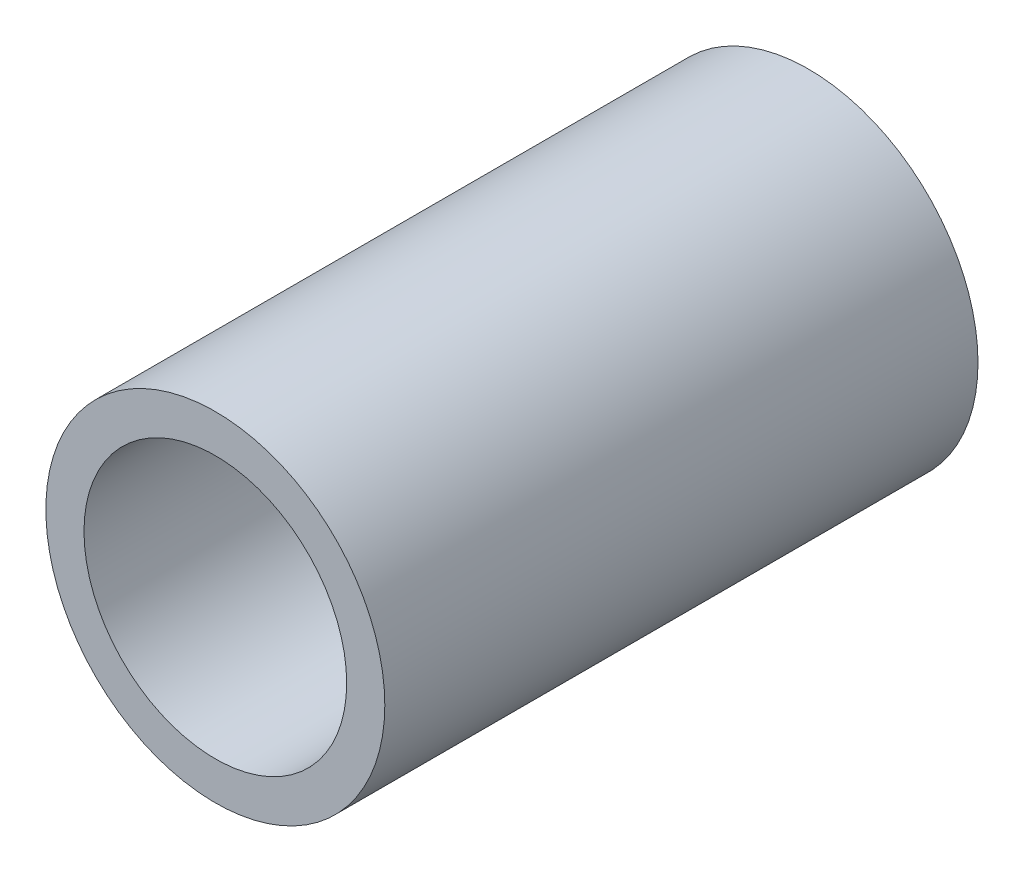
from build123d import *

# Parameters (mm, degrees)
SKETCH_1_R      = 1
SKETCH_1_R_2    = 0.775
EXTRUDE_1_DEPTH = 3.5


with BuildPart() as part:
    # Эскиз1 → Бобышка-Вытянуть1 (new body)
    with BuildSketch(Plane.XY):
        Circle(SKETCH_1_R)
        Circle(SKETCH_1_R_2, mode=Mode.SUBTRACT)
    extrude(amount=EXTRUDE_1_DEPTH)


solid = part.part
